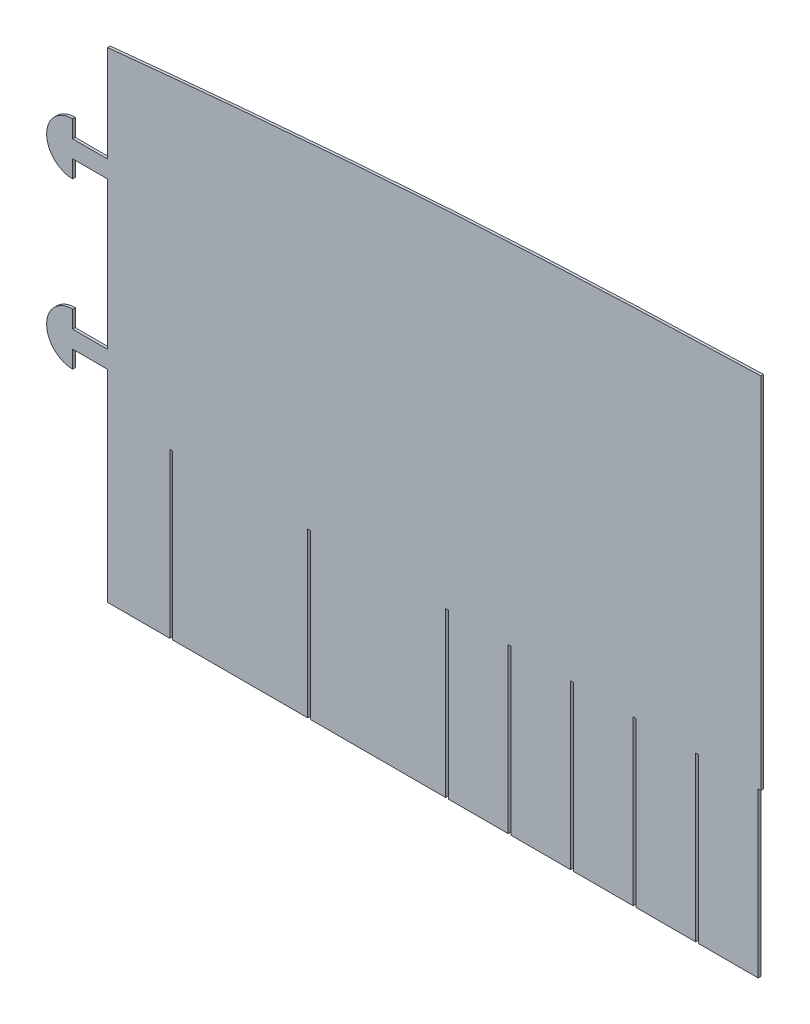
from build123d import *

# Parameters (mm, degrees)
BOSS_EXTRUDE1_DEPTH = 3


with BuildPart() as part:
    # Model → Boss-Extrude1 (new body)
    with BuildSketch(Plane.XY):
        with BuildLine():
            Line((1254.901037796, 442.627781841), (1254.901037796, 462.627781841))
            ThreePointArc((1254.901037796, 462.627781841), (1224.901037796, 432.627781841), (1254.901037796, 402.627781841))
            Line((1254.901037796, 402.627781841), (1254.901037796, 422.627781841))
            Line((1254.901037796, 422.627781841), (1295.101037795, 422.627781841))
            Line((1295.101037795, 422.627781841), (1295.101037795, 252.627781841))
            Line((1295.101037795, 252.627781841), (1254.901037796, 252.627781841))
            Line((1254.901037796, 252.627781841), (1254.901037796, 272.627781841))
            ThreePointArc((1254.901037796, 272.627781841), (1224.901037796, 242.627781841), (1254.901037796, 212.627781841))
            Line((1254.901037796, 212.627781841), (1254.901037796, 232.627781841))
            Line((1254.901037796, 232.627781841), (1295.101037795, 232.627781841))
            Line((1295.101037795, 232.627781841), (1295.101037795, 0))
            Line((1295.101037795, 0), (1366.901037796, 0))
            Line((1366.901037796, 0), (1366.901037796, 188.610331254))
            Line((1366.901037796, 188.610331254), (1369.901037796, 188.610331254))
            Line((1369.901037796, 188.610331254), (1369.901037796, 0))
            Line((1369.901037796, 0), (1525.901037796, 0))
            Line((1525.901037796, 0), (1525.901037796, 188.610331254))
            Line((1525.901037796, 188.610331254), (1528.901037796, 188.610331254))
            Line((1528.901037796, 188.610331254), (1528.901037796, 0))
            Line((1528.901037796, 0), (1684.901037802, 0))
            Line((1684.901037802, 0), (1684.901037802, 188.610331254))
            Line((1684.901037802, 188.610331254), (1687.901037798, 188.610331254))
            Line((1687.901037798, 188.610331254), (1687.901037798, 0))
            Line((1687.901037798, 0), (1756.943542987, 0))
            Line((1756.943542987, 0), (1756.943542987, 188.610331254))
            Line((1756.943542987, 188.610331254), (1759.943542987, 188.610331254))
            Line((1759.943542987, 188.610331254), (1759.943542987, 0))
            Line((1759.943542987, 0), (1828.986048175, 0))
            Line((1828.986048175, 0), (1828.986048175, 188.610331254))
            Line((1828.986048175, 188.610331254), (1831.986048175, 188.610331254))
            Line((1831.986048175, 188.610331254), (1831.986048175, 0))
            Line((1831.986048175, 0), (1901.028553364, 0))
            Line((1901.028553364, 0), (1901.028553364, 188.610331254))
            Line((1901.028553364, 188.610331254), (1904.028553364, 188.610331254))
            Line((1904.028553364, 188.610331254), (1904.028553364, 0))
            Line((1904.028553364, 0), (1973.071058559, 0))
            Line((1973.071058559, 0), (1973.071058559, 188.610331254))
            Line((1973.071058559, 188.610331254), (1976.071058553, 188.610331254))
            Line((1976.071058553, 188.610331254), (1976.071058553, 0))
            Line((1976.071058553, 0), (2045.113563742, 0))
            Line((2045.113563742, 0), (2045.113563742, 188.610331254))
            Line((2045.113563742, 188.610331254), (2048.11356374, 188.610331254))
            Line((2048.11356374, 188.610331254), (2048.11356374, 602.627781841))
            add(Edge.make_bspline(
                [(2048.11356374, 602.627781841), (1934.596406147, 599.111372984), (1718.604938145, 592.182424007), (1441.4869488, 568.541427312), (1295.101037795, 553.889357901)],
                knots=[0.03363534, 0.03363534, 0.03363534, 0.03363534, 0.070138481, 0.108742005, 0.108742005, 0.108742005, 0.108742005], degree=3))
            Line((1295.101037795, 553.889357901), (1295.101037795, 442.627781841))
            Line((1295.101037795, 442.627781841), (1254.901037796, 442.627781841))
        make_face()
    extrude(amount=BOSS_EXTRUDE1_DEPTH)


solid = part.part
